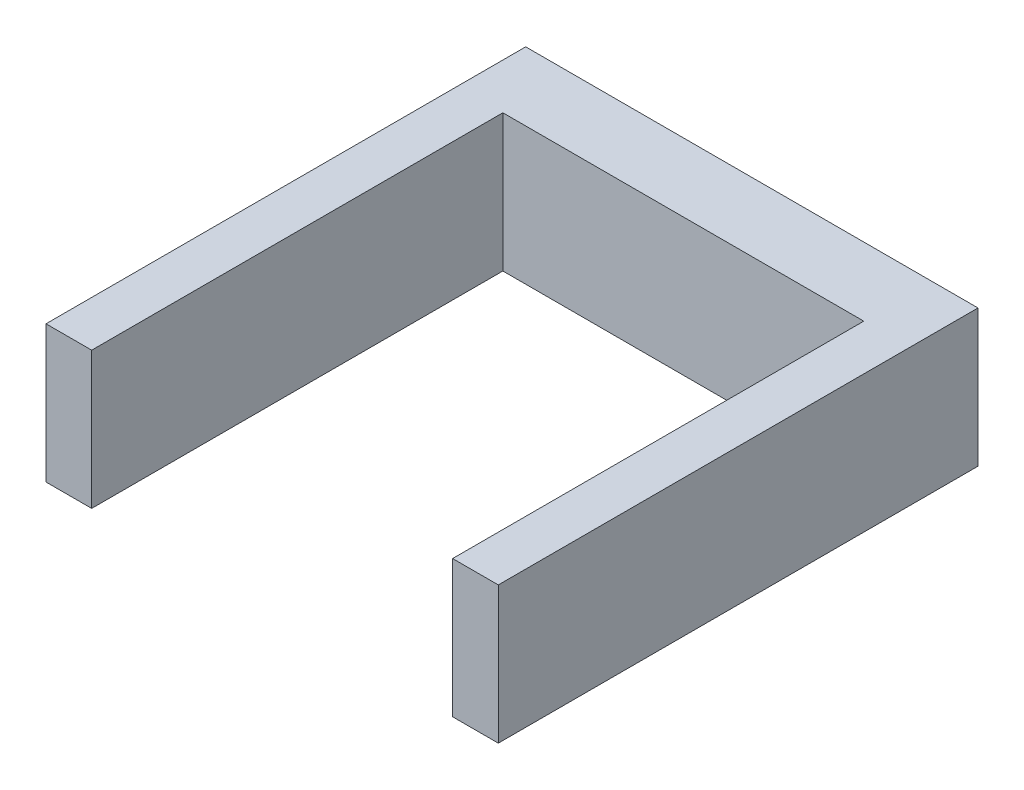
from build123d import *

# Parameters (mm, degrees)
BOSS_EXTRUDE1_DEPTH = 6


with BuildPart() as part:
    # Sketch1 → Boss-Extrude1 (new body)
    with BuildSketch(Plane(origin=(0, 0, 0), x_dir=(1, 0, 0), z_dir=(0, 1, 0))):
        Polygon((-5.773972603, 12.318493151), (-5.773972603, -8.681506849), (-3.773972603, -8.681506849), (-3.773972603, 9.318493151), (12.026027397, 9.318493151), (12.026027397, -8.681506849), (14.026027397, -8.681506849), (14.026027397, 12.318493151), align=None)
    extrude(amount=BOSS_EXTRUDE1_DEPTH)


solid = part.part
